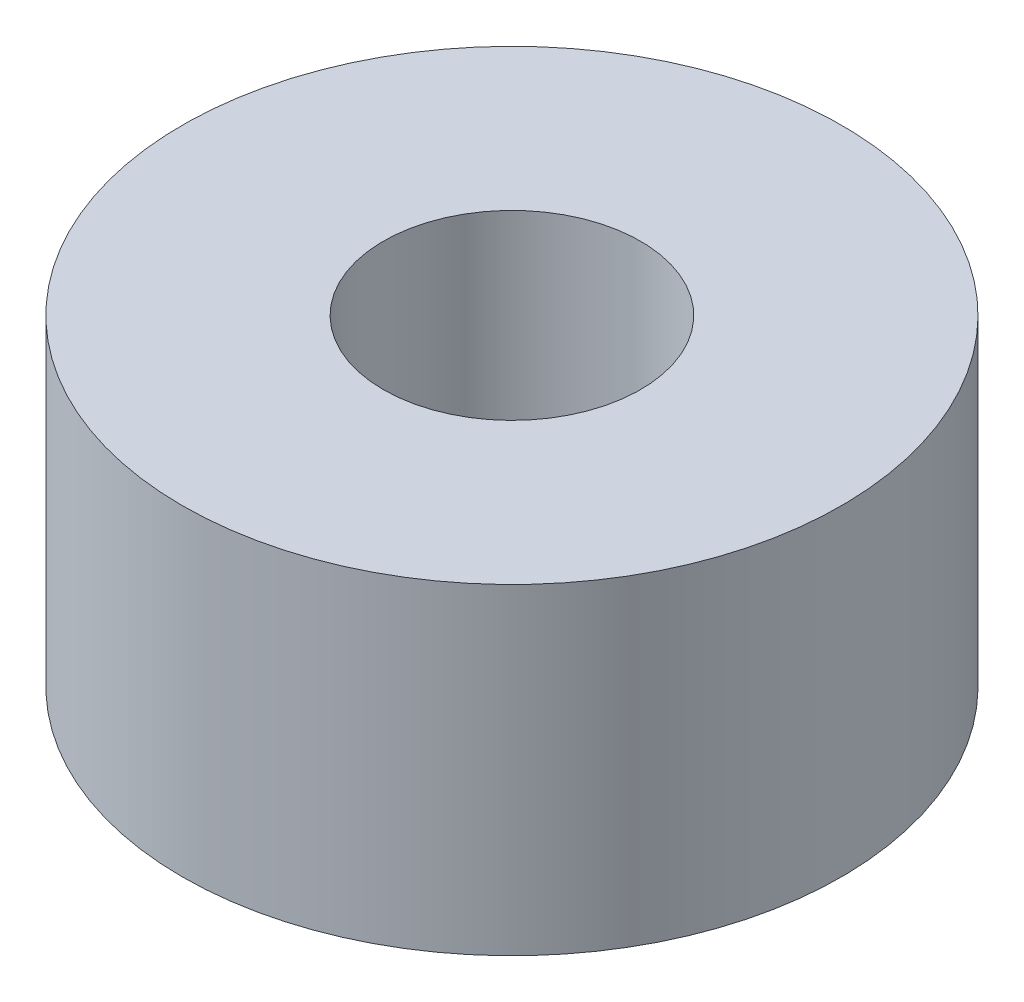
from build123d import *

# Parameters (mm, degrees)
SKETCH1_R           = 5.207
SKETCH1_R_2         = 2.032
BOSS_EXTRUDE1_DEPTH = 5.08


with BuildPart() as part:
    # Sketch1 → Boss-Extrude1 (new body)
    with BuildSketch(Plane(origin=(0, 0, 0), x_dir=(1, 0, 0), z_dir=(0, 1, 0))):
        with Locations(Location((0, 0, 0), (0, 0, 270))):
            Circle(SKETCH1_R)
        with Locations(Location((0, 0, 0), (0, 0, 270))):
            Circle(SKETCH1_R_2, mode=Mode.SUBTRACT)
    extrude(amount=BOSS_EXTRUDE1_DEPTH)


solid = part.part
